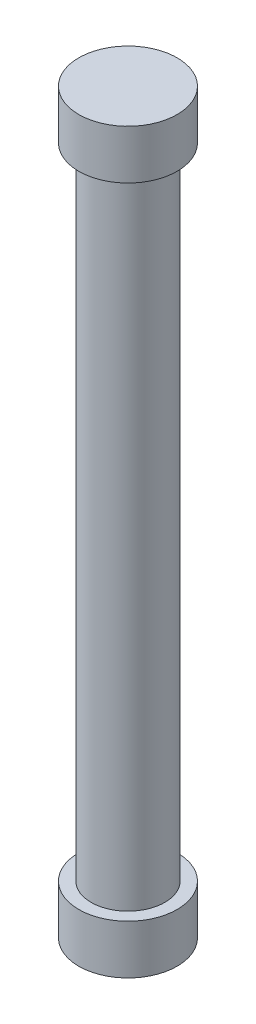
from build123d import *


with BuildPart() as part:
    # Sketch2 → Revolve1 (revolve)
    with BuildSketch(Plane(origin=(0, 0, 0), x_dir=(0, 0, -1), z_dir=(1, 0, 0))):
        Polygon((0.989130435, 27.331521739), (0.989130435, -2.668478261), (-1.010869565, -2.668478261), (-1.010869565, -0.668478261), (-0.510869565, -0.668478261), (-0.510869565, 25.331521739), (-1.010869565, 25.331521739), (-1.010869565, 27.331521739), align=None)
    revolve(axis=Axis((0, 27.331521739, -0.989130435), (0, -1, 0)))


solid = part.part
